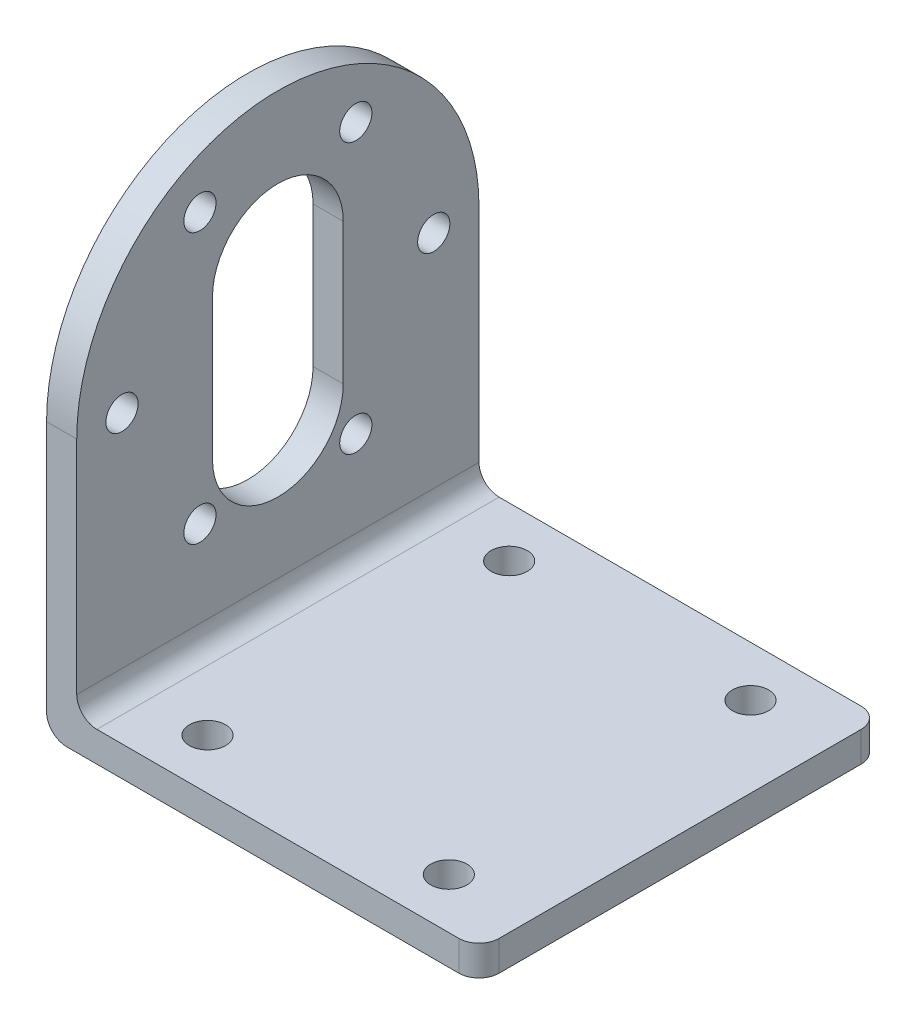
from build123d import *

# Parameters (mm, degrees)
SKETCH_1_R      = 1.6
EXTRUDE_1_DEPTH = 3
SKETCH_2_R      = 1.8
EXTRUDE_2_DEPTH = 3
FILLET_1_R      = 2


with BuildPart() as part:
    # 草图1 → 凸台-拉伸1 (new body)
    with BuildSketch(Plane(origin=(0, 0, 0), x_dir=(0, 0, -1), z_dir=(1, 0, 0))):
        with BuildLine():
            Line((-20, 0), (20, 0))
            Line((20, 0), (20, 27))
            ThreePointArc((20, 27), (0, 47), (-20, 27))
            Line((-20, 27), (-20, 0))
        make_face()
        with Locations((-7.75, 40.423393759)):
            Circle(SKETCH_1_R, mode=Mode.SUBTRACT)
        with Locations((7.75, 40.423393759)):
            Circle(SKETCH_1_R, mode=Mode.SUBTRACT)
        with Locations((15.5, 27)):
            Circle(SKETCH_1_R, mode=Mode.SUBTRACT)
        with Locations((7.75, 13.576606241)):
            Circle(SKETCH_1_R, mode=Mode.SUBTRACT)
        with Locations((-7.75, 13.576606241)):
            Circle(SKETCH_1_R, mode=Mode.SUBTRACT)
        with Locations((-15.5, 27)):
            Circle(SKETCH_1_R, mode=Mode.SUBTRACT)
        with BuildLine():
            Line((6.5, 32.5), (6.5, 18.5))
            ThreePointArc((6.5, 18.5), (0, 12), (-6.5, 18.5))
            Line((-6.5, 18.5), (-6.5, 32.5))
            ThreePointArc((-6.5, 32.5), (0, 39), (6.5, 32.5))
        make_face(mode=Mode.SUBTRACT)
    extrude(amount=EXTRUDE_1_DEPTH)

    # 草图2 → 凸台-拉伸2 (add)
    with BuildSketch(Plane.XZ):
        with BuildLine():
            Line((0, 20), (41, 20))
            ThreePointArc((41, 20), (42.414213562, 19.414213562), (43, 18))
            Line((43, 18), (43, -18))
            ThreePointArc((43, -18), (42.414213562, -19.414213562), (41, -20))
            Line((41, -20), (0, -20))
            Line((0, -20), (0, 20))
        make_face()
        with Locations(Location((11, 15, 0), (0, 0, 270))):
            Circle(SKETCH_2_R, mode=Mode.SUBTRACT)
        with Locations(Location((35, 15, 0), (0, 0, 270))):
            Circle(SKETCH_2_R, mode=Mode.SUBTRACT)
        with Locations(Location((11, -15, 0), (0, 0, 270))):
            Circle(SKETCH_2_R, mode=Mode.SUBTRACT)
        with Locations(Location((35, -15, 0), (0, 0, 270))):
            Circle(SKETCH_2_R, mode=Mode.SUBTRACT)
    extrude(amount=-EXTRUDE_2_DEPTH)

    # 圆角1
    fillet_1_edges = [part.edges().sort_by_distance(p)[0] for p in [
        (0, 0, 0),
        (3, 3, 0),
    ]]
    fillet(fillet_1_edges, radius=FILLET_1_R)


solid = part.part
